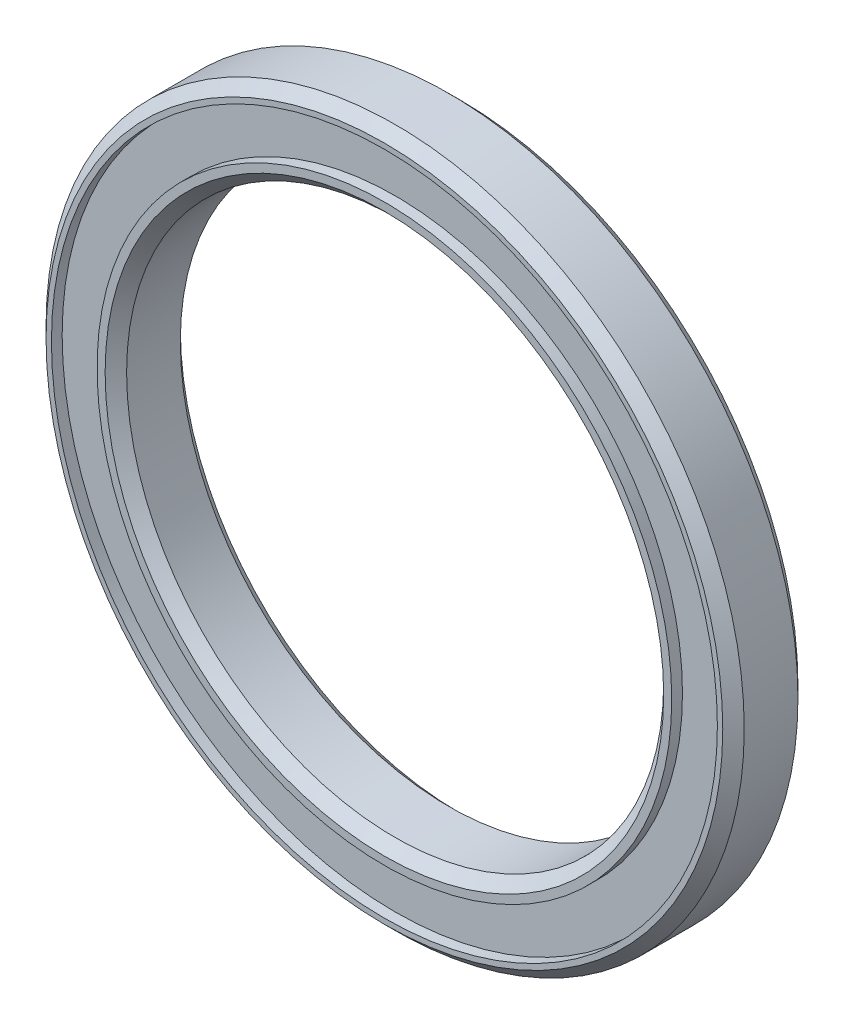
from build123d import *

# Parameters (mm, degrees)
SKETCH1_R           = 32.5
SKETCH1_R_2         = 25
BOSS_EXTRUDE1_DEPTH = 3.5
SKETCH2_R           = 31
SKETCH2_R_2         = 26.75
CUT_EXTRUDE1_DEPTH  = 1
CHAMFER1_SIZE       = 1


with BuildPart() as part:
    # Sketch1 → Boss-Extrude1 (new, symmetric)
    with BuildSketch(Plane.XY):
        Circle(SKETCH1_R)
        Circle(SKETCH1_R_2, mode=Mode.SUBTRACT)
    extrude(amount=BOSS_EXTRUDE1_DEPTH, both=True)

    # Sketch2 → Cut-Extrude1 (cut)
    with BuildSketch(Plane.XY.offset(3.5)):
        Circle(SKETCH2_R)
        Circle(SKETCH2_R_2, mode=Mode.SUBTRACT)
    cut_extrude1 = extrude(amount=-CUT_EXTRUDE1_DEPTH, mode=Mode.SUBTRACT)

    # Mirror1: Cut-Extrude1 across plane
    add(cut_extrude1.mirror(Plane.XY), mode=Mode.SUBTRACT)

    # Chamfer1
    chamfer1_edges = [part.edges().sort_by_distance(p)[0] for p in [
        (-32.5, 0, -3.5),
        (-32.5, 0, 3.5),
        (-25, 0, -3.5),
        (-25, 0, 3.5),
    ]]
    chamfer(chamfer1_edges, length=CHAMFER1_SIZE)


solid = part.part
